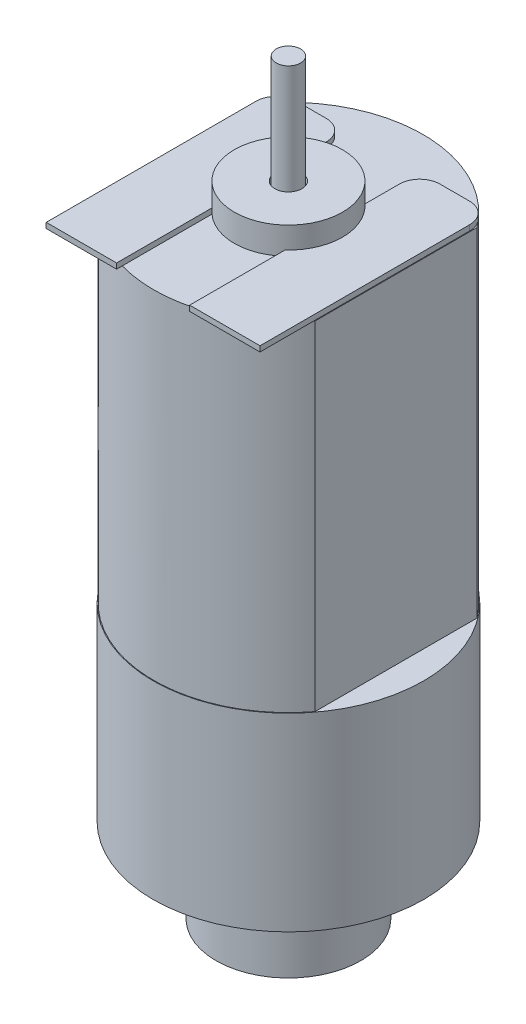
from build123d import *

# Parameters (mm, degrees)
SKETCH2_R           = 5
BOSS_EXTRUDE1_DEPTH = 7
BOSS_EXTRUDE2_DEPTH = 12.5
BOSS_EXTRUDE3_DEPTH = 0.2
SKETCH5_R           = 2
BOSS_EXTRUDE4_DEPTH = 1
SKETCH6_R           = 0.5
CUT_EXTRUDE1_DEPTH  = 2
SKETCH7_R           = 0.45
BOSS_EXTRUDE5_DEPTH = 6
SKETCH8_R           = 3.5
BOSS_EXTRUDE6_DEPTH = 0.02
SKETCH9_R           = 2.675
BOSS_EXTRUDE7_DEPTH = 3.1
SKETCH10_R          = 1.675
CUT_EXTRUDE2_DEPTH  = 2


with BuildPart() as part:
    # Sketch2 → Boss-Extrude1 (new body)
    with BuildSketch(Plane(origin=(0, 0, 0), x_dir=(1, 0, 0), z_dir=(0, 1, 0))):
        with Locations(Location((0, 0, 0), (0, 0, 270))):
            Circle(SKETCH2_R)
    extrude(amount=BOSS_EXTRUDE1_DEPTH)

    # Sketch3 → Boss-Extrude2 (add)
    with BuildSketch(Plane(origin=(0, 7, 0), x_dir=(1, 0, 0), z_dir=(0, 1, 0))):
        with BuildLine():
            Line((-3.975, 2.99165506), (-3.975, -2.99165506))
            ThreePointArc((-3.975, -2.99165506), (0, -4.975), (3.975, -2.99165506))
            Line((3.975, -2.99165506), (3.975, 2.99165506))
            ThreePointArc((3.975, 2.99165506), (0, 4.975), (-3.975, 2.99165506))
        make_face()
    extrude(amount=BOSS_EXTRUDE2_DEPTH)

    # Sketch4 → Boss-Extrude3 (add)
    with BuildSketch(Plane(origin=(0, 19.5, 0), x_dir=(1, 0, 0), z_dir=(0, 1, 0))):
        with BuildLine():
            Line((-3.2, 3.5), (-2.1, 3.5))
            ThreePointArc((-2.1, 3.5), (-1.569669914, 3.280330086), (-1.35, 2.75))
            Line((-1.35, 2.75), (-1.35, -5))
            Line((-1.35, -5), (-3.95, -5))
            Line((-3.95, -5), (-3.95, 2.75))
            ThreePointArc((-3.95, 2.75), (-3.730330086, 3.280330086), (-3.2, 3.5))
        make_face()
        with BuildLine():
            Line((3.95, -5), (1.35, -5))
            Line((1.35, -5), (1.35, 2.75))
            ThreePointArc((1.35, 2.75), (1.569669914, 3.280330086), (2.1, 3.5))
            Line((2.1, 3.5), (3.2, 3.5))
            ThreePointArc((3.2, 3.5), (3.730330086, 3.280330086), (3.95, 2.75))
            Line((3.95, 2.75), (3.95, -5))
        make_face()
    extrude(amount=BOSS_EXTRUDE3_DEPTH)

    # Sketch5 → Boss-Extrude4 (add)
    with BuildSketch(Plane(origin=(0, 19.5, 0), x_dir=(1, 0, 0), z_dir=(0, 1, 0))):
        with Locations(Location((0, 0, 0), (0, 0, 47.545849796))):
            Circle(SKETCH5_R)
    extrude(amount=BOSS_EXTRUDE4_DEPTH)

    # Sketch6 → Cut-Extrude1 (cut)
    with BuildSketch(Plane(origin=(0, 20.5, 0), x_dir=(1, 0, 0), z_dir=(0, 1, 0))):
        with Locations(Location((0, 0, 0), (0, 0, 270))):
            Circle(SKETCH6_R)
    extrude(amount=-CUT_EXTRUDE1_DEPTH, mode=Mode.SUBTRACT)

    # Sketch7 → Boss-Extrude5 (add)
    with BuildSketch(Plane(origin=(0, 18.5, 0), x_dir=(1, 0, 0), z_dir=(0, 1, 0))):
        with Locations(Location((0, 0, 0), (0, 0, 270))):
            Circle(SKETCH7_R)
    extrude(amount=BOSS_EXTRUDE5_DEPTH)

    # Sketch8 → Boss-Extrude6 (add)
    with BuildSketch(Plane.XZ):
        with Locations(Location((0, 0, 0), (0, 0, 90))):
            Circle(SKETCH8_R)
    extrude(amount=BOSS_EXTRUDE6_DEPTH)

    # Sketch9 → Boss-Extrude7 (add)
    with BuildSketch(Plane.XZ.offset(0.02)):
        with Locations(Location((0, 0, 0), (0, 0, 90))):
            Circle(SKETCH9_R)
    extrude(amount=BOSS_EXTRUDE7_DEPTH)

    # Sketch10 → Cut-Extrude2 (cut)
    with BuildSketch(Plane.XZ.offset(3.12)):
        with Locations(Location((0, 0, 0), (0, 0, 270))):
            Circle(SKETCH10_R)
    extrude(amount=-CUT_EXTRUDE2_DEPTH, mode=Mode.SUBTRACT)


solid = part.part
